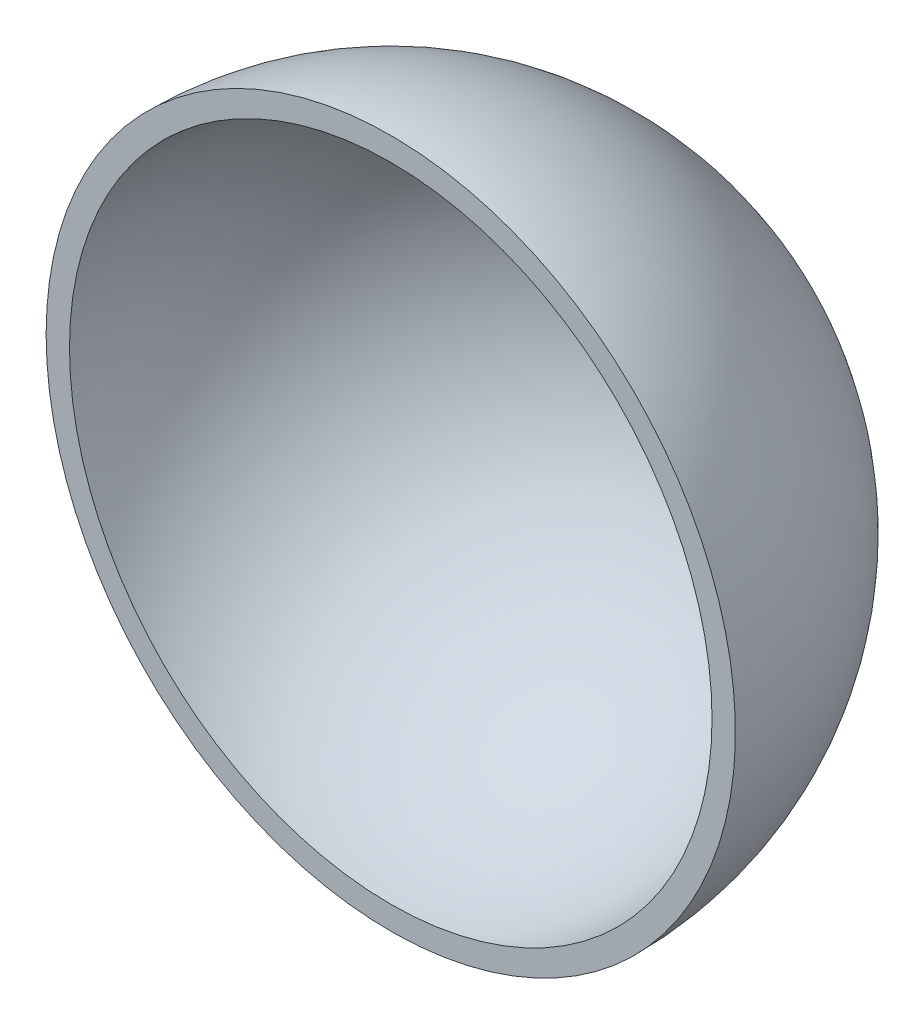
from build123d import *

# Parameters (mm, degrees)
REVOLVE_THIN1_ANGLE = 180


with BuildPart() as part:
    # Sketch1 → Revolve-Thin1 (revolve)
    with BuildSketch(Plane.XY):
        with BuildLine():
            ThreePointArc((118, 0), (0, -118), (-118, 0))
            Line((-118, 0), (-110, 0))
            ThreePointArc((-110, 0), (0, -110), (110, 0))
            Line((110, 0), (118, 0))
        make_face()
    revolve(axis=Axis((-118, 0, 0), (1, 0, 0)), revolution_arc=REVOLVE_THIN1_ANGLE)


solid = part.part
